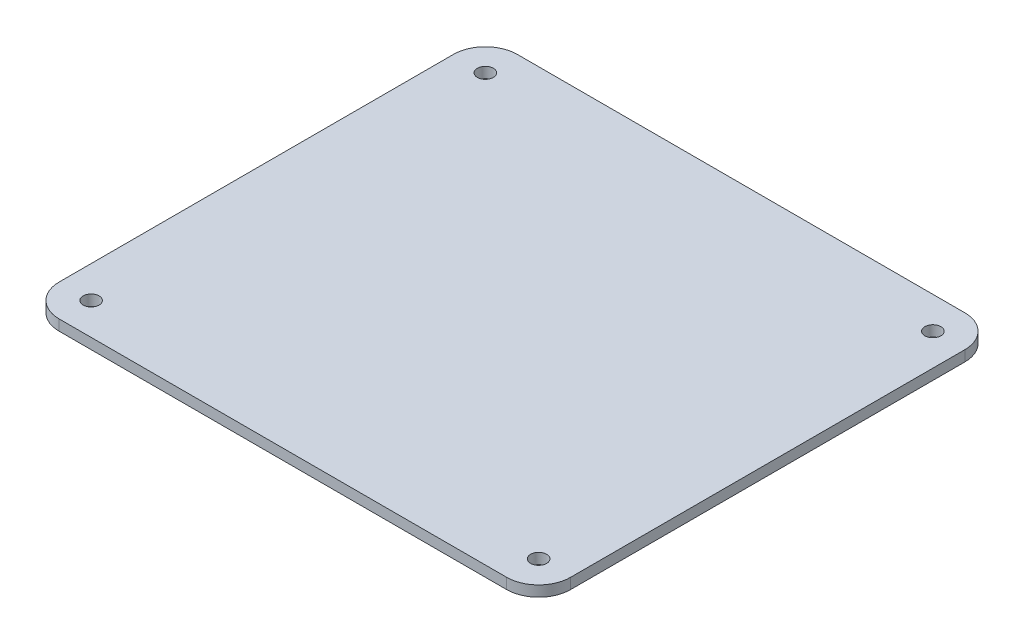
from build123d import *

# Parameters (mm, degrees)
SKETCH1_R           = 1.5
BOSS_EXTRUDE1_DEPTH = 2


with BuildPart() as part:
    # Sketch1 → Boss-Extrude1 (new body)
    with BuildSketch(Plane(origin=(0, 0, 0), x_dir=(1, 0, 0), z_dir=(0, 1, 0))):
        with BuildLine():
            Line((-42, -43), (42, -43))
            ThreePointArc((42, -43), (46.242640687, -41.242640687), (48, -37))
            Line((48, -37), (48, 37))
            ThreePointArc((48, 37), (46.242640687, 41.242640687), (42, 43))
            Line((42, 43), (-42, 43))
            ThreePointArc((-42, 43), (-46.242640687, 41.242640687), (-48, 37))
            Line((-48, 37), (-48, -37))
            ThreePointArc((-48, -37), (-46.242640687, -41.242640687), (-42, -43))
        make_face()
        with Locations(Location((-42, 37, 0), (0, 0, 270))):
            Circle(SKETCH1_R, mode=Mode.SUBTRACT)
        with Locations(Location((42, 37, 0), (0, 0, 270))):
            Circle(SKETCH1_R, mode=Mode.SUBTRACT)
        with Locations(Location((42, -37, 0), (0, 0, 270))):
            Circle(SKETCH1_R, mode=Mode.SUBTRACT)
        with Locations(Location((-42, -37, 0), (0, 0, 270))):
            Circle(SKETCH1_R, mode=Mode.SUBTRACT)
    extrude(amount=BOSS_EXTRUDE1_DEPTH)


solid = part.part
